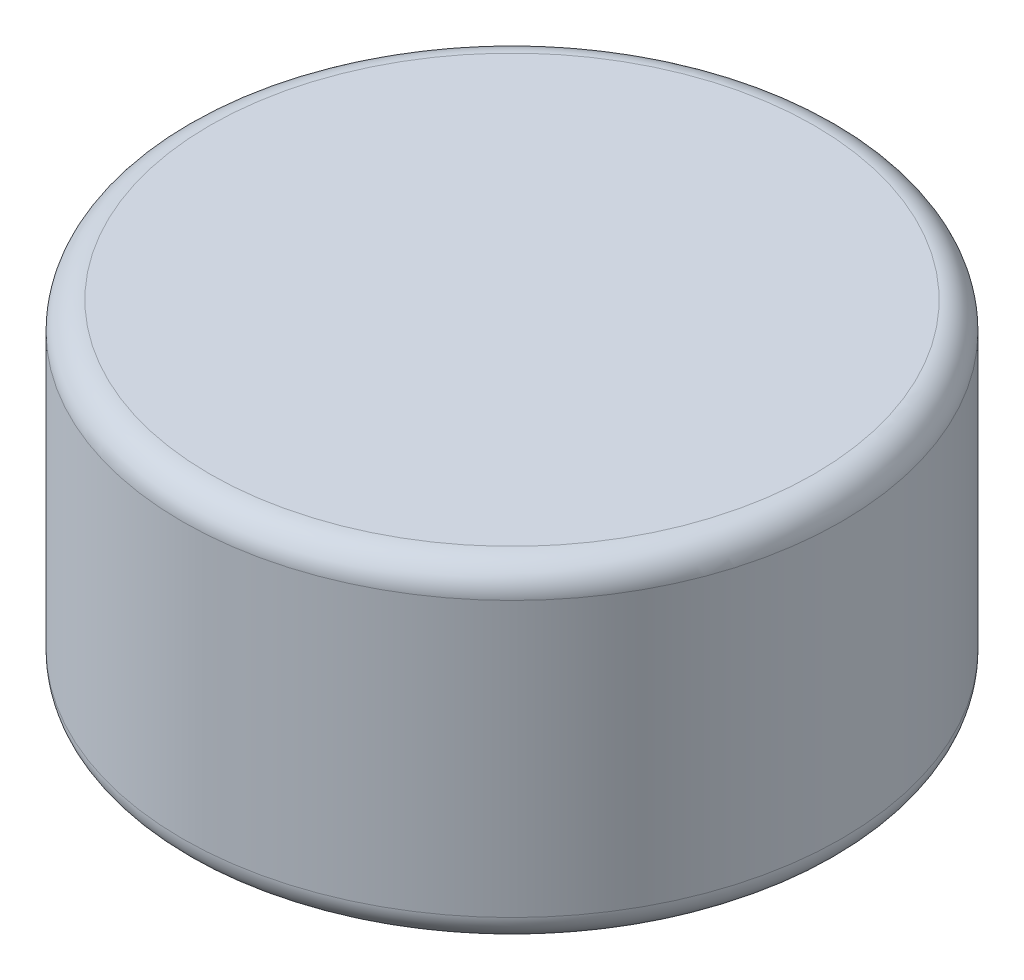
from build123d import *

# Parameters (mm, degrees)
SKETCH1_R           = 3
BOSS_EXTRUDE1_DEPTH = 3
FILLET1_R           = 0.25


with BuildPart() as part:
    # Sketch1 → Boss-Extrude1 (new body)
    with BuildSketch(Plane(origin=(0, 0, 0), x_dir=(1, 0, 0), z_dir=(0, 1, 0))):
        with Locations(Location((0, 0, 0), (0, 0, 270))):
            Circle(SKETCH1_R)
    extrude(amount=BOSS_EXTRUDE1_DEPTH)

    # Fillet1
    fillet1_edges = [part.edges().sort_by_distance(p)[0] for p in [
        (0, 0, -3),
        (0, 3, -3),
    ]]
    fillet(fillet1_edges, radius=FILLET1_R)


solid = part.part
